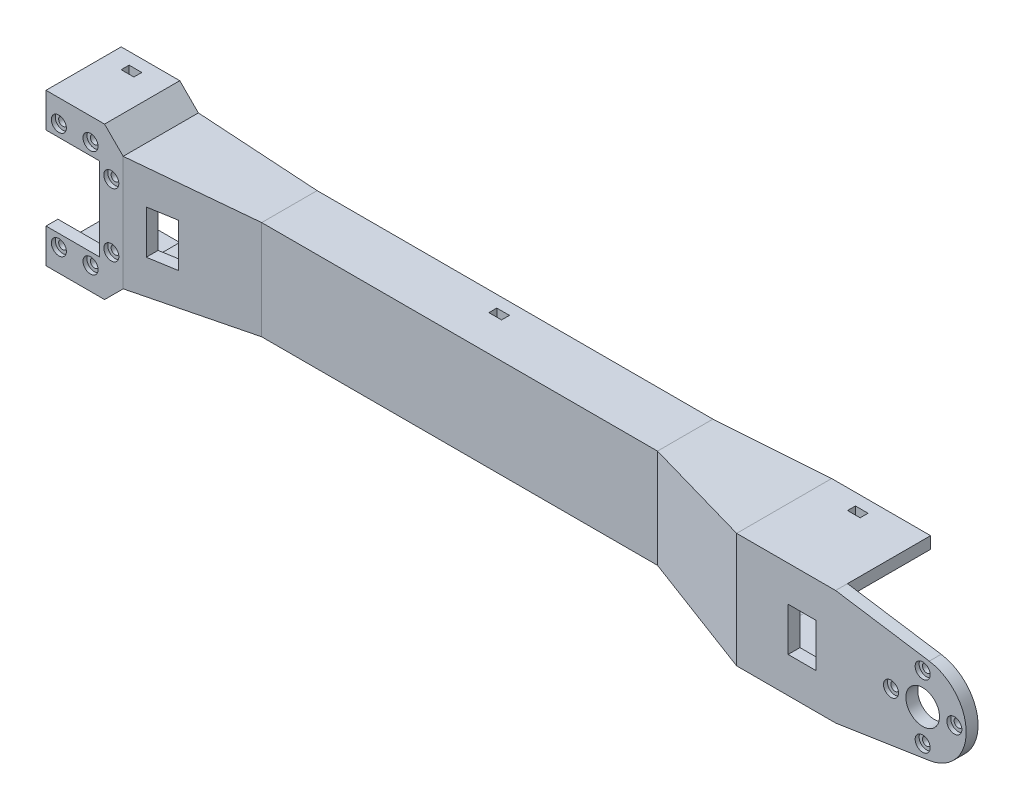
from build123d import *

# Parameters (mm, degrees)
BOSS_EXTRUDE1_DEPTH = 3
CUT_EXTRUDE1_REACH  = 66.915
SKETCH2_R           = 4.25
SKETCH2_R_2         = 1.05
SKETCH3_R           = 1.9
CUT_EXTRUDE2_DEPTH  = 1
BOSS_EXTRUDE2_DEPTH = 29
BOSS_EXTRUDE4_DEPTH = 3
CUT_EXTRUDE3_REACH  = 184.811
SKETCH8_R           = 1.05
SKETCH9_R           = 1.9
CUT_EXTRUDE4_DEPTH  = 1
CUT_EXTRUDE5_REACH  = 185.098
BOSS_EXTRUDE8_REACH = 186.206
SKETCH16_W          = 3.2
SKETCH16_H          = 2
CUT_EXTRUDE6_DEPTH  = 186.123769408
CUT_EXTRUDE7_REACH  = 186.206
SKETCH17_W          = 7
SKETCH17_H          = 11


with BuildPart() as part:
    # Sketch1 → Boss-Extrude1 (new body)
    with BuildSketch(Plane.XY):
        with BuildLine():
            Line((25, 29), (48.666332079, 25.373055569))
            ThreePointArc((48.666332079, 25.373055569), (58, 14.5), (48.666332079, 3.626944431))
            Line((48.666332079, 3.626944431), (25, 0))
            Line((25, 0), (0, 0))
            Line((0, 0), (0, 29))
            Line((0, 29), (25, 29))
        make_face()
    extrude(amount=-BOSS_EXTRUDE1_DEPTH)

    # Sketch2 → Cut-Extrude1 (cut, up to next)
    with BuildSketch(Plane.XY, mode=Mode.PRIVATE) as cut_extrude1_sk1:
        with Locations((47, 14.5)):
            Circle(SKETCH2_R)
    cut_extrude1_tool1 = extrude(cut_extrude1_sk1.sketch, amount=-CUT_EXTRUDE1_REACH, mode=Mode.PRIVATE) & part.part
    # Sketch2 → Cut-Extrude1 (cut, up to next)
    with BuildSketch(Plane.XY, mode=Mode.PRIVATE) as cut_extrude1_sk2:
        with Locations((47, 22.5)):
            Circle(SKETCH2_R_2)
    cut_extrude1_tool2 = extrude(cut_extrude1_sk2.sketch, amount=-CUT_EXTRUDE1_REACH, mode=Mode.PRIVATE) & part.part
    # Sketch2 → Cut-Extrude1 (cut, up to next)
    with BuildSketch(Plane.XY, mode=Mode.PRIVATE) as cut_extrude1_sk3:
        with Locations((55, 14.5)):
            Circle(SKETCH2_R_2)
    cut_extrude1_tool3 = extrude(cut_extrude1_sk3.sketch, amount=-CUT_EXTRUDE1_REACH, mode=Mode.PRIVATE) & part.part
    # Sketch2 → Cut-Extrude1 (cut, up to next)
    with BuildSketch(Plane.XY, mode=Mode.PRIVATE) as cut_extrude1_sk4:
        with Locations((47, 6.5)):
            Circle(SKETCH2_R_2)
    cut_extrude1_tool4 = extrude(cut_extrude1_sk4.sketch, amount=-CUT_EXTRUDE1_REACH, mode=Mode.PRIVATE) & part.part
    # Sketch2 → Cut-Extrude1 (cut, up to next)
    with BuildSketch(Plane.XY, mode=Mode.PRIVATE) as cut_extrude1_sk5:
        with Locations((39, 14.5)):
            Circle(SKETCH2_R_2)
    cut_extrude1_tool5 = extrude(cut_extrude1_sk5.sketch, amount=-CUT_EXTRUDE1_REACH, mode=Mode.PRIVATE) & part.part
    add(cut_extrude1_tool1.solids().sort_by_distance((47, 14.5, 0))[0], mode=Mode.SUBTRACT)
    add(cut_extrude1_tool2.solids().sort_by_distance((47, 22.5, 0))[0], mode=Mode.SUBTRACT)
    add(cut_extrude1_tool3.solids().sort_by_distance((55, 14.5, 0))[0], mode=Mode.SUBTRACT)
    add(cut_extrude1_tool4.solids().sort_by_distance((47, 6.5, 0))[0], mode=Mode.SUBTRACT)
    add(cut_extrude1_tool5.solids().sort_by_distance((39, 14.5, 0))[0], mode=Mode.SUBTRACT)

    # Sketch3 → Cut-Extrude2 (cut)
    with BuildSketch(Plane.XY):
        with Locations((47, 22.5)):
            Circle(SKETCH3_R)
        with Locations((55, 14.5)):
            Circle(SKETCH3_R)
        with Locations((47, 6.5)):
            Circle(SKETCH3_R)
        with Locations((39, 14.5)):
            Circle(SKETCH3_R)
    extrude(amount=-CUT_EXTRUDE2_DEPTH, mode=Mode.SUBTRACT)

    # Sketch4 → Boss-Extrude2 (add)
    with BuildSketch(Plane(origin=(0, 29, 0), x_dir=(1, 0, 0), z_dir=(0, 1, 0))):
        Polygon((0, 3), (0, 0), (-30, 10), (-130, 10), (-160, 5), (-160, 8), (-130, 13), (-30, 13), align=None)
    extrude(amount=-BOSS_EXTRUDE2_DEPTH)

    # Sketch7 → Boss-Extrude4 (add)
    with BuildSketch(Plane.XY.offset(-5)):
        Polygon((-160, 29), (-164.7, 33.7), (-179.5, 33.7), (-179.5, 25), (-166, 25), (-166, 4), (-179.5, 4), (-179.5, -4.7), (-164.7, -4.7), (-160, 0), align=None)
    extrude(amount=-BOSS_EXTRUDE4_DEPTH)

    # Sketch8 → Cut-Extrude3 (cut, up to next)
    with BuildSketch(Plane.XY.offset(-5), mode=Mode.PRIVATE) as cut_extrude3_sk1:
        with Locations((-176.25, 28)):
            Circle(SKETCH8_R)
    cut_extrude3_tool1 = extrude(cut_extrude3_sk1.sketch, amount=-CUT_EXTRUDE3_REACH, mode=Mode.PRIVATE) & part.part
    # Sketch8 → Cut-Extrude3 (cut, up to next)
    with BuildSketch(Plane.XY.offset(-5), mode=Mode.PRIVATE) as cut_extrude3_sk2:
        with Locations((-168.25, 28)):
            Circle(SKETCH8_R)
    cut_extrude3_tool2 = extrude(cut_extrude3_sk2.sketch, amount=-CUT_EXTRUDE3_REACH, mode=Mode.PRIVATE) & part.part
    # Sketch8 → Cut-Extrude3 (cut, up to next)
    with BuildSketch(Plane.XY.offset(-5), mode=Mode.PRIVATE) as cut_extrude3_sk3:
        with Locations((-163, 22.5)):
            Circle(SKETCH8_R)
    cut_extrude3_tool3 = extrude(cut_extrude3_sk3.sketch, amount=-CUT_EXTRUDE3_REACH, mode=Mode.PRIVATE) & part.part
    # Sketch8 → Cut-Extrude3 (cut, up to next)
    with BuildSketch(Plane.XY.offset(-5), mode=Mode.PRIVATE) as cut_extrude3_sk4:
        with Locations((-163, 6.5)):
            Circle(SKETCH8_R)
    cut_extrude3_tool4 = extrude(cut_extrude3_sk4.sketch, amount=-CUT_EXTRUDE3_REACH, mode=Mode.PRIVATE) & part.part
    # Sketch8 → Cut-Extrude3 (cut, up to next)
    with BuildSketch(Plane.XY.offset(-5), mode=Mode.PRIVATE) as cut_extrude3_sk5:
        with Locations((-168.25, 1)):
            Circle(SKETCH8_R)
    cut_extrude3_tool5 = extrude(cut_extrude3_sk5.sketch, amount=-CUT_EXTRUDE3_REACH, mode=Mode.PRIVATE) & part.part
    # Sketch8 → Cut-Extrude3 (cut, up to next)
    with BuildSketch(Plane.XY.offset(-5), mode=Mode.PRIVATE) as cut_extrude3_sk6:
        with Locations((-176.25, 1)):
            Circle(SKETCH8_R)
    cut_extrude3_tool6 = extrude(cut_extrude3_sk6.sketch, amount=-CUT_EXTRUDE3_REACH, mode=Mode.PRIVATE) & part.part
    add(cut_extrude3_tool1.solids().sort_by_distance((-176.25, 28, -5))[0], mode=Mode.SUBTRACT)
    add(cut_extrude3_tool2.solids().sort_by_distance((-168.25, 28, -5))[0], mode=Mode.SUBTRACT)
    add(cut_extrude3_tool3.solids().sort_by_distance((-163, 22.5, -5))[0], mode=Mode.SUBTRACT)
    add(cut_extrude3_tool4.solids().sort_by_distance((-163, 6.5, -5))[0], mode=Mode.SUBTRACT)
    add(cut_extrude3_tool5.solids().sort_by_distance((-168.25, 1, -5))[0], mode=Mode.SUBTRACT)
    add(cut_extrude3_tool6.solids().sort_by_distance((-176.25, 1, -5))[0], mode=Mode.SUBTRACT)

    # Sketch9 → Cut-Extrude4 (cut)
    with BuildSketch(Plane.XY.offset(-5)):
        with Locations((-176.25, 28)):
            Circle(SKETCH9_R)
        with Locations((-168.25, 28)):
            Circle(SKETCH9_R)
        with Locations((-163, 22.5)):
            Circle(SKETCH9_R)
        with Locations((-163, 6.5)):
            Circle(SKETCH9_R)
        with Locations((-168.25, 1)):
            Circle(SKETCH9_R)
        with Locations((-176.25, 1)):
            Circle(SKETCH9_R)
    extrude(amount=-CUT_EXTRUDE4_DEPTH, mode=Mode.SUBTRACT)

    # Cut-Extrude5: up to this face of the body (flat: up to its plane)
    cut_extrude5_end = Plane(part.part.faces().sort_by_distance((-80, 14.5, -13))[0])
    # Sketch11 → Cut-Extrude5 (cut, up to the picked face)
    with BuildSketch(Plane.XY, mode=Mode.PRIVATE) as cut_extrude5_sk1:
        Polygon((0, 0), (-30, 2), (-130, 2), (-160, 0), align=None)
    cut_extrude5_tool1 = split(extrude(cut_extrude5_sk1.sketch, amount=-CUT_EXTRUDE5_REACH, mode=Mode.PRIVATE), bisect_by=cut_extrude5_end, keep=Keep.BOTH, mode=Mode.PRIVATE)
    # Sketch11 → Cut-Extrude5 (cut, up to the picked face)
    with BuildSketch(Plane.XY, mode=Mode.PRIVATE) as cut_extrude5_sk2:
        Polygon((0, 29), (-30, 27), (-130, 27), (-160, 29), align=None)
    cut_extrude5_tool2 = split(extrude(cut_extrude5_sk2.sketch, amount=-CUT_EXTRUDE5_REACH, mode=Mode.PRIVATE), bisect_by=cut_extrude5_end, keep=Keep.BOTH, mode=Mode.PRIVATE)
    add(cut_extrude5_tool1.solids().sort_by(Axis((-80, 0.923077, 0), (0, 0, -1)))[0], mode=Mode.SUBTRACT)
    add(cut_extrude5_tool2.solids().sort_by(Axis((-80, 28.076923, 0), (0, 0, -1)))[0], mode=Mode.SUBTRACT)

    # Sketch14 → Boss-Extrude8 (add, up to next)
    with BuildSketch(Plane.XY.offset(-24), mode=Mode.PRIVATE) as boss_extrude8_sk1:
        Polygon((-179.5, 33.7), (-179.5, 30.7), (-164.7, 30.7), (-160, 26), (-130, 24), (-30, 24), (0, 26), (25, 26), (25, 29), (0, 29), (-30, 27), (-130, 27), (-160, 29), (-164.7, 33.7), align=None)
    boss_extrude8_tool1 = extrude(boss_extrude8_sk1.sketch, amount=BOSS_EXTRUDE8_REACH, mode=Mode.PRIVATE) - part.part
    boss_extrude8 = boss_extrude8_tool1.solids().sort_by_distance((-77.25, 26.622763, -24))[0]
    add(boss_extrude8)

    # Mirror1: Boss-Extrude8 across plane
    add(boss_extrude8.mirror(Plane.ZX.offset(14.5)))

    # Sketch16 → Cut-Extrude6 (cut, through all)
    with BuildSketch(Plane(origin=(0, 33.7, 0), x_dir=(1, 0, 0), z_dir=(0, 1, 0))):
        with Locations((-172.9, 20)):
            Rectangle(SKETCH16_W, SKETCH16_H)
        with Locations((-80, 20)):
            Rectangle(SKETCH16_W, SKETCH16_H)
        with Locations((10.6, 20)):
            Rectangle(SKETCH16_W, SKETCH16_H)
    extrude(amount=-CUT_EXTRUDE6_DEPTH, mode=Mode.SUBTRACT)

    # Sketch17 → Cut-Extrude7 (cut, up to next)
    with BuildSketch(Plane.XY, mode=Mode.PRIVATE) as cut_extrude7_sk1:
        with Locations((-151.5, 14.5)):
            Rectangle(SKETCH17_W, SKETCH17_H)
    cut_extrude7_tool1 = extrude(cut_extrude7_sk1.sketch, amount=-CUT_EXTRUDE7_REACH, mode=Mode.PRIVATE) & part.part
    # Sketch17 → Cut-Extrude7 (cut, up to next)
    with BuildSketch(Plane.XY, mode=Mode.PRIVATE) as cut_extrude7_sk2:
        with Locations((16.5, 14.5)):
            Rectangle(SKETCH17_W, SKETCH17_H)
    cut_extrude7_tool2 = extrude(cut_extrude7_sk2.sketch, amount=-CUT_EXTRUDE7_REACH, mode=Mode.PRIVATE) & part.part
    add(cut_extrude7_tool1.solids().sort_by_distance((-151.5, 14.5, 0))[0], mode=Mode.SUBTRACT)
    add(cut_extrude7_tool2.solids().sort_by_distance((16.5, 14.5, 0))[0], mode=Mode.SUBTRACT)


solid = part.part
